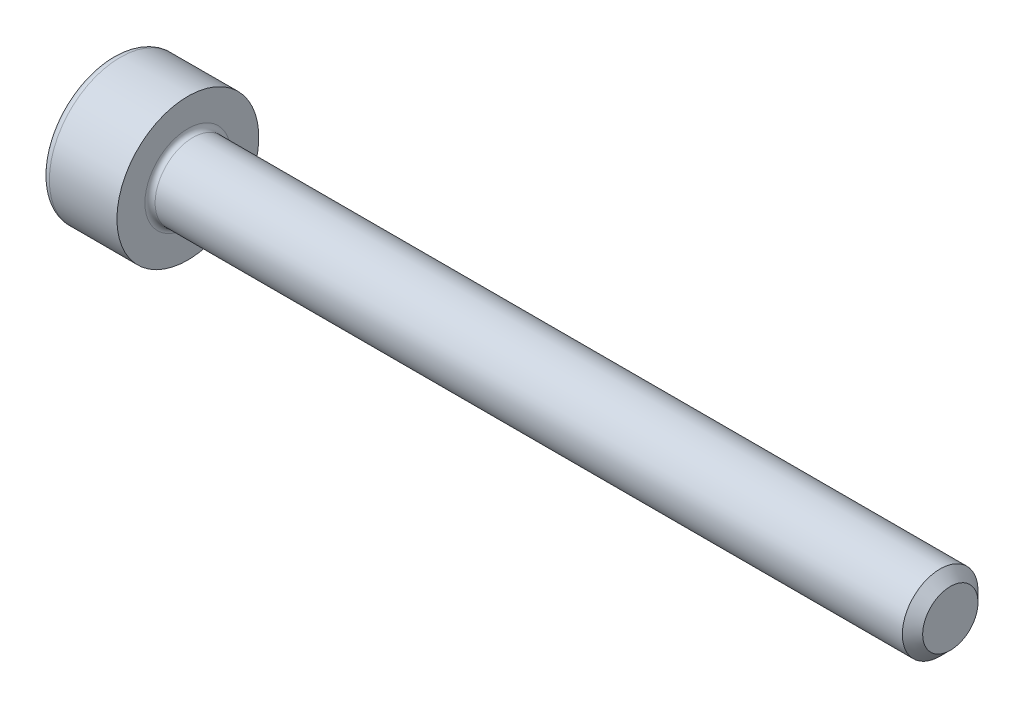
from build123d import *

# Parameters (mm, degrees)
FILLET1_R      = 0.1
FILLET2_R      = 0.16
CHAMFER1_SIZE  = 0.2
EXTRUDE1_DEPTH = 0.7


with BuildPart() as part:
    # Sketch1 → Revolve1 (revolve)
    with BuildSketch(Plane.XY, mode=Mode.PRIVATE) as revolve1_sk:
        Polygon((0, 1.395688245), (0, 0), (16.488734128, 0), (16.488734128, 0.744367064), (1.488734128, 0.744367064), (1.488734128, 1.395688245), align=None)
    revolve(revolve1_sk.sketch.rotate(Axis((0, 0, 0), (1, 0, 0)), 90), axis=Axis((0, 0, 0), (1, 0, 0)))

    # Fillet1
    fillet1_edges = [part.edges().sort_by_distance(p)[0] for p in [
        (1.488734128, 0, -0.744367064),
    ]]
    fillet(fillet1_edges, radius=FILLET1_R)

    # Fillet2
    fillet2_edges = [part.edges().sort_by_distance(p)[0] for p in [
        (0, 0, -1.395688245),
    ]]
    fillet(fillet2_edges, radius=FILLET2_R)

    # Chamfer1
    chamfer1_edges = [part.edges().sort_by_distance(p)[0] for p in [
        (16.488734128, 0, -0.744367064),
    ]]
    chamfer(chamfer1_edges, length=CHAMFER1_SIZE)

    # Sketch2 → Extrude1 (cut)
    with BuildSketch(Plane.ZY):
        Polygon((0, 0.877572409), (-0.76, 0.438786205), (-0.76, -0.438786205), (0, -0.877572409), (0.76, -0.438786205), (0.76, 0.438786205), align=None)
    extrude(amount=-EXTRUDE1_DEPTH, mode=Mode.SUBTRACT)


solid = part.part
